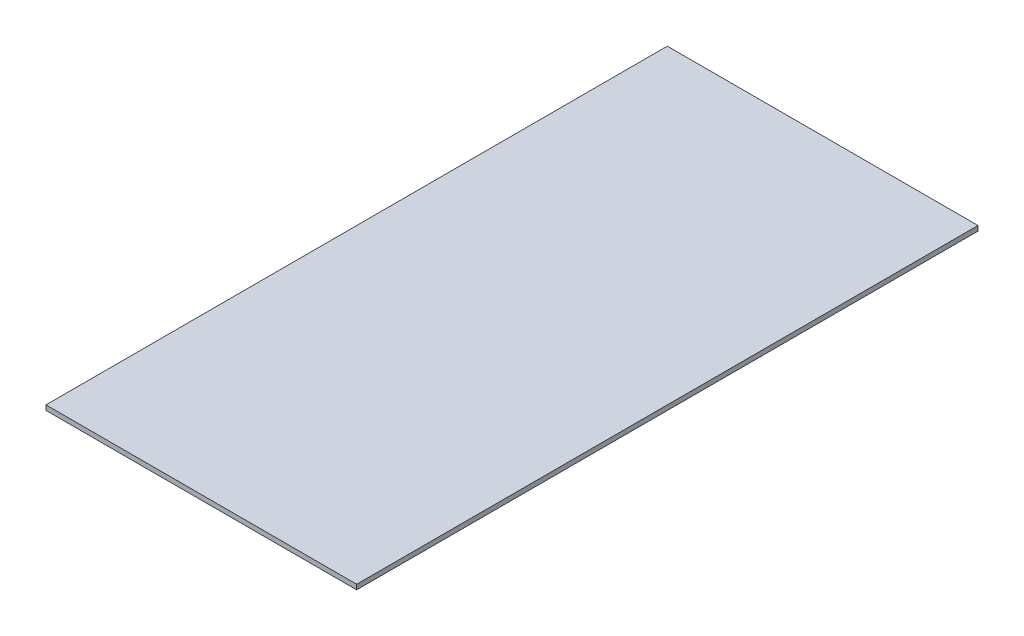
from build123d import *

# Parameters (mm, degrees)
SKETCH1_W           = 1219.2
SKETCH1_H           = 2438.4
BOSS_EXTRUDE1_DEPTH = 19.05


with BuildPart() as part:
    # Sketch1 → Boss-Extrude1 (new body)
    with BuildSketch(Plane(origin=(0, 0, 0), x_dir=(1, 0, 0), z_dir=(0, 1, 0))):
        Rectangle(SKETCH1_W, SKETCH1_H)
    extrude(amount=BOSS_EXTRUDE1_DEPTH)


solid = part.part
